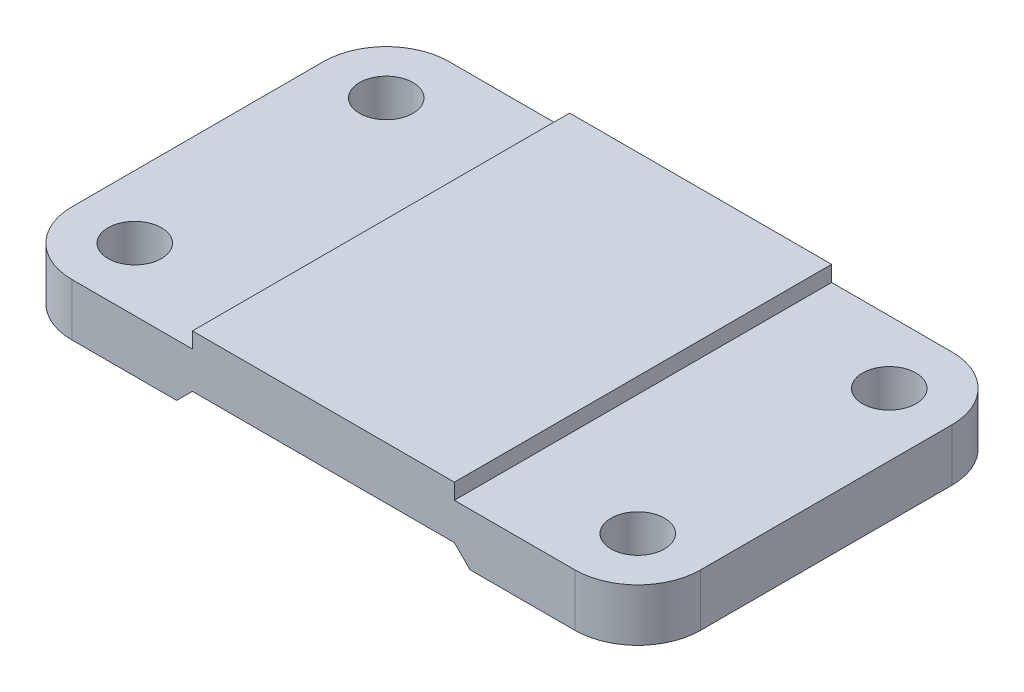
from build123d import *

# Parameters (mm, degrees)
BOSS_EXTRUDE2_DEPTH = 72
FILLET1_R           = 12
SKETCH3_R           = 5.1
CUT_EXTRUDE1_DEPTH  = 141.545366341


with BuildPart() as part:
    # Sketch2 → Boss-Extrude2 (new body)
    with BuildSketch(Plane.XY):
        Polygon((0, 0), (0, 10), (35, 10), (35, 13), (85, 13), (85, 10), (120, 10), (120, 0), (88, 0), (85, 3), (35, 3), (32, 0), align=None)
    extrude(amount=BOSS_EXTRUDE2_DEPTH)

    # Fillet1
    fillet1_edges = [part.edges().sort_by_distance(p)[0] for p in [
        (0, 5, 0),
        (120, 5, 0),
        (120, 5, 72),
        (0, 5, 72),
    ]]
    fillet(fillet1_edges, radius=FILLET1_R)

    # Sketch3 → Cut-Extrude1 (cut, through all)
    with BuildSketch(Plane(origin=(0, 0, 0), x_dir=(1, 0, 0), z_dir=(0, 1, 0))):
        with Locations(Location((12, -12, 0), (0, 0, 270))):
            Circle(SKETCH3_R)
        with Locations(Location((12, -60, 0), (0, 0, 270))):
            Circle(SKETCH3_R)
        with Locations(Location((108, -60, 0), (0, 0, 90))):
            Circle(SKETCH3_R)
        with Locations(Location((108, -12, 0), (0, 0, 90))):
            Circle(SKETCH3_R)
    extrude(amount=CUT_EXTRUDE1_DEPTH, mode=Mode.SUBTRACT)


solid = part.part
